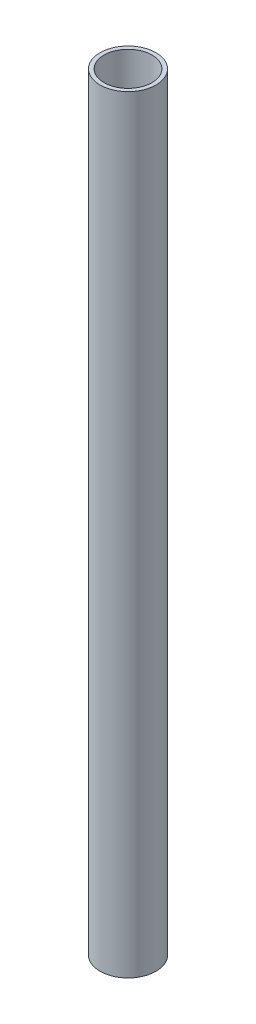
from build123d import *

# Parameters (mm, degrees)
SKETCH1_R           = 44.45
SKETCH1_R_2         = 38.1
BOSS_EXTRUDE1_DEPTH = 609.6


with BuildPart() as part:
    # Sketch1 → Boss-Extrude1 (new, symmetric)
    with BuildSketch(Plane(origin=(0, 0, 0), x_dir=(1, 0, 0), z_dir=(0, 1, 0))):
        with Locations(Location((0, 0, 0), (0, 0, 90))):
            Circle(SKETCH1_R)
        with Locations(Location((0, 0, 0), (0, 0, 90))):
            Circle(SKETCH1_R_2, mode=Mode.SUBTRACT)
    extrude(amount=BOSS_EXTRUDE1_DEPTH, both=True)


solid = part.part
